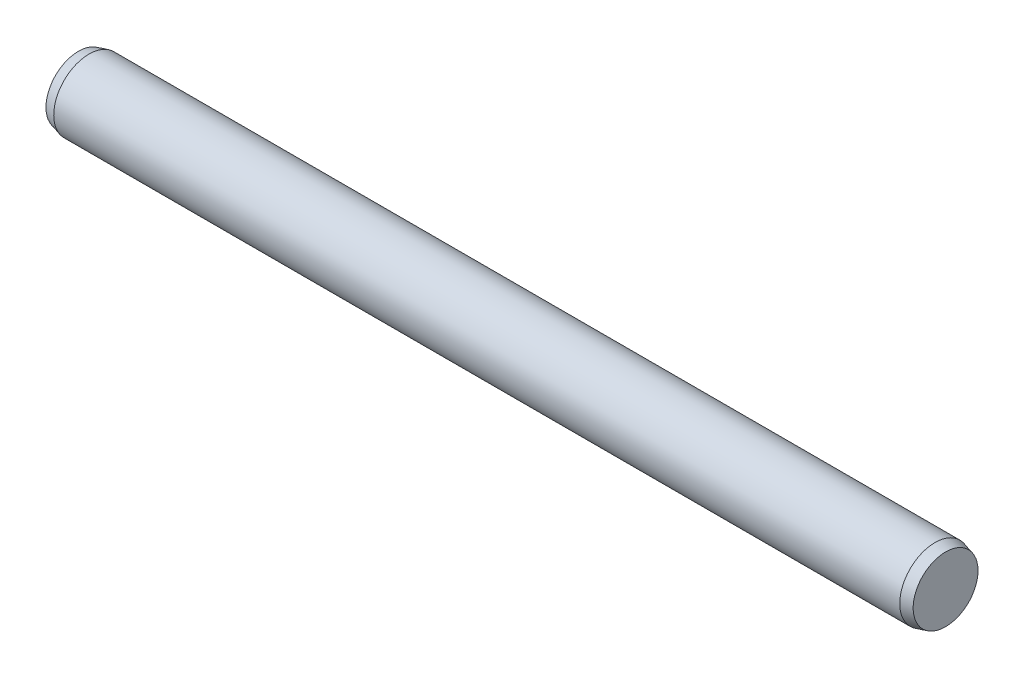
from build123d import *

# Parameters (mm, degrees)
EXTRUDE1_DEPTH      = 12
EXTRUDE1_DEPTH_BACK = 12
SKETCH2_R           = 1
SKETCH3_R           = 1
EXTRUDE2_DEPTH      = 0.3
EXTRUDE2_TAPER      = 15
SKETCH4_R           = 1
EXTRUDE3_DEPTH      = 0.3
EXTRUDE3_TAPER      = 15


with BuildPart() as part:
    # Sketch2 → Extrude1 (new, two sides: drawn at the far end of the back side and taken through both)
    with BuildSketch(Plane(origin=(0, 0, 0), x_dir=(0, 0, -1), z_dir=(1, 0, 0)).offset(-EXTRUDE1_DEPTH_BACK)):
        Circle(SKETCH2_R)
    extrude(amount=EXTRUDE1_DEPTH + EXTRUDE1_DEPTH_BACK)

    # Sketch3 → Extrude2 (add)
    with BuildSketch(Plane(origin=(12, 0, 0), x_dir=(0, 0, -1), z_dir=(1, 0, 0))):
        Circle(SKETCH3_R)
    extrude(amount=EXTRUDE2_DEPTH, taper=EXTRUDE2_TAPER)

    # Sketch4 → Extrude3 (add)
    with BuildSketch(Plane.ZY.offset(12)):
        with Locations(Location((0, 0, 0), (0, 0, 180))):
            Circle(SKETCH4_R)
    extrude(amount=EXTRUDE3_DEPTH, taper=EXTRUDE3_TAPER)


solid = part.part
